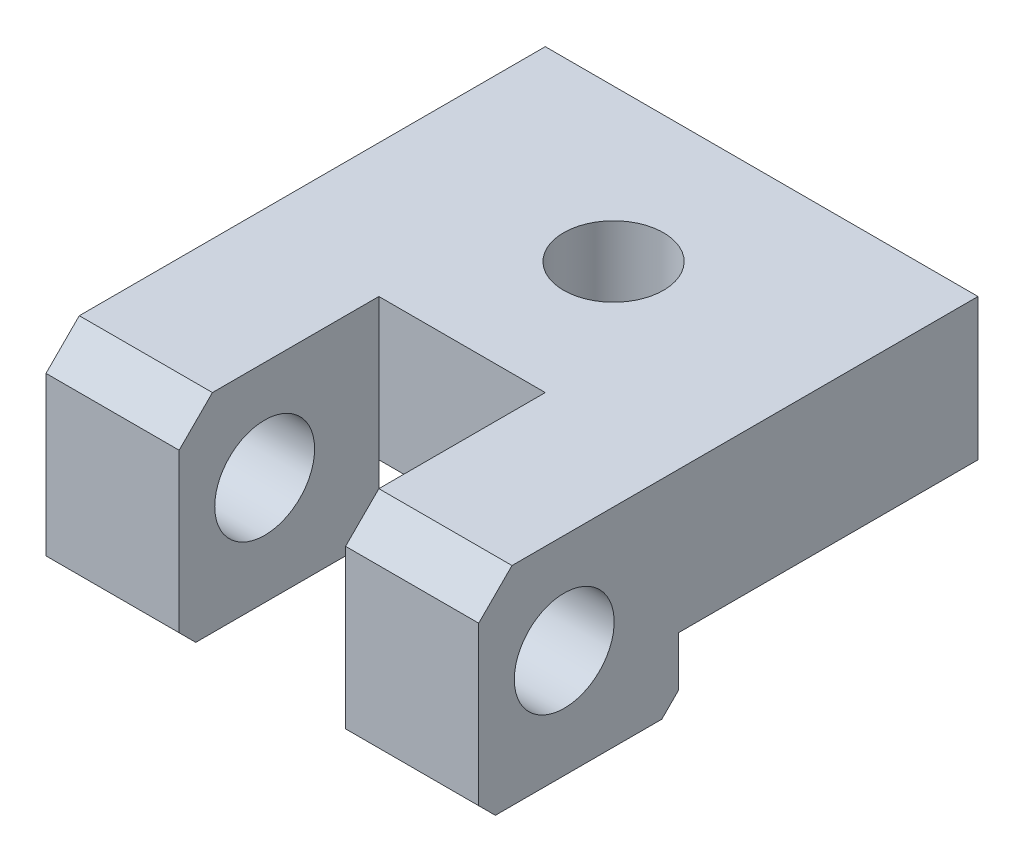
from build123d import *

# Parameters (mm, degrees)
SKETCH_1_W            = 30
SKETCH_1_H            = 13.5
EXTRUDE_1_DEPTH       = 20
SKETCH_2_W            = 10
SKETCH_2_H            = 20.163242361
CUT_EXTRUDE_2_DEPTH   = 29.41214529
SKETCH_3_R            = 3
CUT_EXTRUDE_3_DEPTH   = 37.827299657
SKETCH_6_W            = 30
SKETCH_6_H            = 13.5
EXTRUDE_5_DEPTH       = 10
SKETCH_7_R            = 3
CUT_EXTRUDE_1_DEPTH   = 29.41214529
SKETCH_8_W            = 30
SKETCH_8_H            = 18
CUT_EXTRUDE_2_2_DEPTH = 5
CHAMFER_1_SIZE        = 2
SKETCH_9_W            = 6.52399098
SKETCH_9_H            = 33.458140235
CUT_EXTRUDE_6_DEPTH   = 29.41214529
SKETCH_14_W           = 84.903926308
SKETCH_14_H           = 44.963333207
CUT_EXTRUDE_10_DEPTH  = 1
SKETCH_15_R           = 2.000000004
CUT_EXTRUDE_3_2_DEPTH = 16


with BuildPart() as part:
    # Эскиз1 → Вытянуть1 (new body)
    with BuildSketch(Plane.XY):
        with Locations((0, -0.75)):
            Rectangle(SKETCH_1_W, SKETCH_1_H)
    extrude(amount=EXTRUDE_1_DEPTH)

    # Эскиз2 → Cut-Extrude 2 (cut, through all)
    with BuildSketch(Plane.XZ.offset(7.5)):
        with Locations((0, 18.081621181)):
            Rectangle(SKETCH_2_W, SKETCH_2_H)
    extrude(amount=-CUT_EXTRUDE_2_DEPTH, mode=Mode.SUBTRACT)

    # Эскиз3 → Cut-Extrude 3 (cut, through all)
    with BuildSketch(Plane(origin=(15, 0, 0), x_dir=(0, 0, -1), z_dir=(1, 0, 0))):
        with Locations(Location((-14.861357689, 0, 0), (0, 0, 90))):
            Circle(SKETCH_3_R)
    extrude(amount=-CUT_EXTRUDE_3_DEPTH, mode=Mode.SUBTRACT)

    # Эскиз6 → Вытянуть5 (add)
    with BuildSketch(Plane(origin=(0, 0, 0), x_dir=(-1, 0, 0), z_dir=(0, 0, -1))):
        with Locations((0, -0.75)):
            Rectangle(SKETCH_6_W, SKETCH_6_H)
    extrude(amount=EXTRUDE_5_DEPTH)

    # Эскиз7 → Вырез-Вытянуть1 (cut, through all)
    with BuildSketch(Plane(origin=(0, 6, 0), x_dir=(1, 0, 0), z_dir=(0, 1, 0))):
        with Locations(Location((0.231400022, 0.869933179, 0), (0, 0, 270))):
            Circle(SKETCH_7_R)
    extrude(amount=-CUT_EXTRUDE_1_DEPTH, mode=Mode.SUBTRACT)

    # Эскиз8 → Cut-Extrude 2 2 (cut)
    with BuildSketch(Plane.XZ.offset(7.5)):
        with Locations((0, -1)):
            Rectangle(SKETCH_8_W, SKETCH_8_H)
    extrude(amount=-CUT_EXTRUDE_2_2_DEPTH, mode=Mode.SUBTRACT)

    # Фаска1
    chamfer_1_edges = [part.edges().sort_by_distance(p)[0] for p in [
        (-10, -7.5, 20),
        (-10, 6, 20),
        (10, -7.5, 20),
        (10, -7.5, 8),
        (-10, -7.5, 8),
        (10, 6, 20),
    ]]
    chamfer(chamfer_1_edges, length=CHAMFER_1_SIZE)

    # Эскиз9 → Вытянуть6 (cut, through all)
    with BuildSketch(Plane(origin=(0, 6, 0), x_dir=(1, 0, 0), z_dir=(0, 1, 0))):
        with Locations((16.26199549, -3.329208479)):
            Rectangle(SKETCH_9_W, SKETCH_9_H)
        with Locations((-16.26199549, -3.329208479)):
            Rectangle(SKETCH_9_W, SKETCH_9_H)
    extrude(amount=-CUT_EXTRUDE_6_DEPTH, mode=Mode.SUBTRACT)

    # Эскиз14 → Вытянуть10 (cut)
    with BuildSketch(Plane.XZ.offset(7.5)):
        with Locations((0.061866905, -0.327668242)):
            Rectangle(SKETCH_14_W, SKETCH_14_H)
    extrude(amount=-CUT_EXTRUDE_10_DEPTH, mode=Mode.SUBTRACT)

    # Эскиз15 → Cut-Extrude 3 2 (cut)
    with BuildSketch(Plane(origin=(0, 0, -10), x_dir=(-1, 0, 0), z_dir=(0, 0, -1))):
        with Locations((-7.999999896, 1.748498224)):
            Circle(SKETCH_15_R)
        with Locations((8.000000104, 1.750000003)):
            Circle(SKETCH_15_R)
    extrude(amount=-CUT_EXTRUDE_3_2_DEPTH, mode=Mode.SUBTRACT)


solid = part.part
